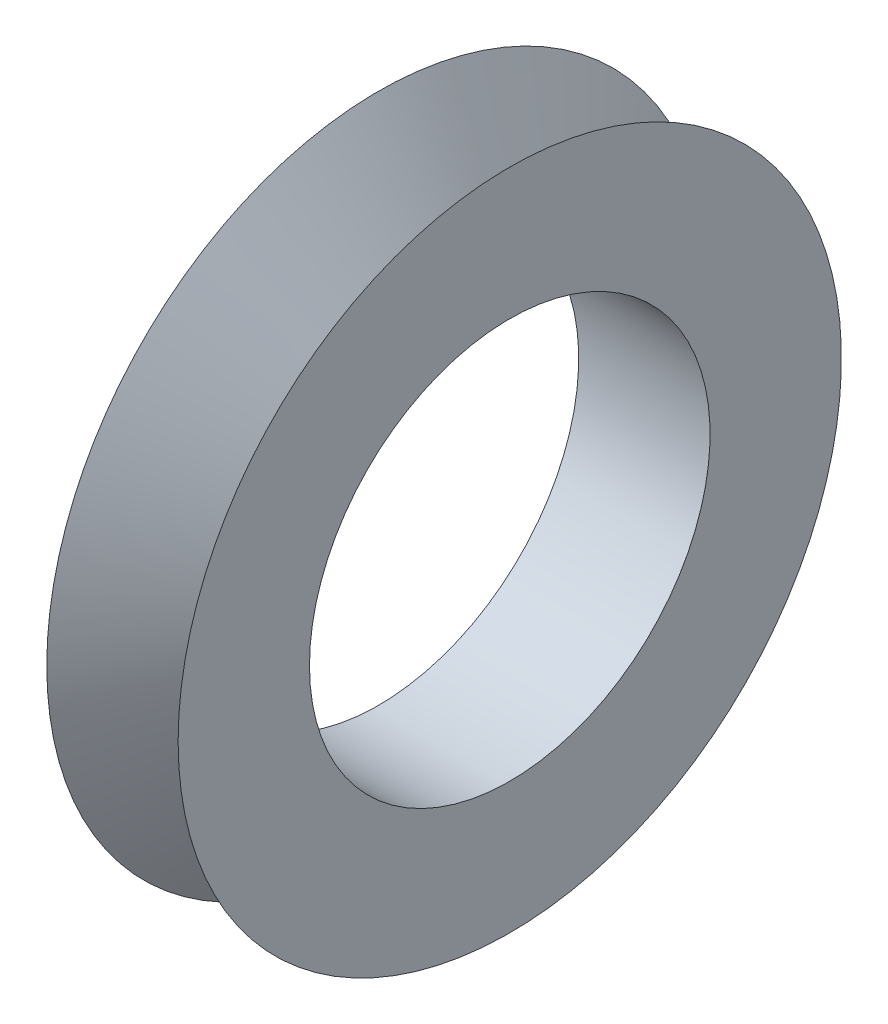
from build123d import *


with BuildPart() as part:
    # Sketch5 → Revolve4 (revolve)
    with BuildSketch(Plane.XY, mode=Mode.PRIVATE) as revolve4_sk:
        Polygon((-2, 6.1), (2, 6.1), (2, 10.1), (0, 7.1), (-2, 10.1), align=None)
    revolve(revolve4_sk.sketch.rotate(Axis((-6.924078091, 0, 0), (1, 0, 0)), 90), axis=Axis((-6.924078091, 0, 0), (1, 0, 0)))


solid = part.part
